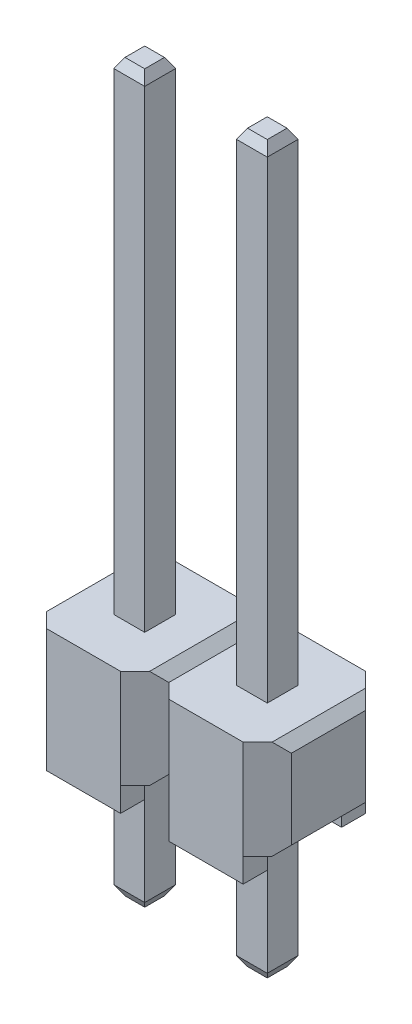
from build123d import *
from OCP.BRepFilletAPI import BRepFilletAPI_MakeChamfer

# Parameters (mm, degrees)
SKETCH1_W                = 0.64
SKETCH1_H                = 0.64
BOSS_EXTRUDE1_DEPTH      = 2.05
CUT_EXTRUDE1_DEPTH       = 5
SKETCH3_W                = 1.54
SKETCH3_H                = 0.5
BOSS_EXTRUDE2_DEPTH      = 0.5
BOSS_EXTRUDE3_DEPTH      = 10
BOSS_EXTRUDE3_DEPTH_BACK = 5.05
SKETCH4_W                = 0.64
SKETCH4_H                = 0.64
CHAMFER1_SIZE            = 0.2
CHAMFER1_SIZE2           = 0.115470054
SKETCH5_R                = 0.125
CUT_EXTRUDE2_DEPTH       = 1


with BuildPart() as part:
    # Sketch1 → Boss-Extrude1 (new body)
    with BuildSketch(Plane(origin=(0, 0, 0), x_dir=(1, 0, 0), z_dir=(0, 1, 0))):
        Polygon((-2.04, -1.27), (-0.5, -1.27), (0, -0.77), (0.5, -1.27), (2.04, -1.27), (2.54, -0.77), (2.54, 0.77), (2.04, 1.27), (0.5, 1.27), (0, 0.77), (-0.5, 1.27), (-2.04, 1.27), (-2.54, 0.77), (-2.54, -0.77), align=None)
        with Locations((1.27, 0)):
            Rectangle(SKETCH1_W, SKETCH1_H, mode=Mode.SUBTRACT)
        with Locations((-1.27, 0)):
            Rectangle(SKETCH1_W, SKETCH1_H, mode=Mode.SUBTRACT)
    extrude(amount=-BOSS_EXTRUDE1_DEPTH)

    # Sketch2 → Cut-Extrude1 (cut, symmetric)
    with BuildSketch(Plane.XY):
        Polygon((-2.54, -0.2), (-2.54, 0), (-2.34, 0), align=None)
        Polygon((-0.2, 0), (0.2, 0), (0, -0.2), align=None)
        Polygon((2.34, 0), (2.54, 0), (2.54, -0.2), align=None)
        Polygon((-2.54, -1.85), (-2.34, -2.05), (-2.54, -2.05), align=None)
        Polygon((-0.2, -2.05), (0, -1.85), (0.2, -2.05), align=None)
        Polygon((2.34, -2.05), (2.54, -1.85), (2.54, -2.05), align=None)
    extrude(amount=CUT_EXTRUDE1_DEPTH, both=True, mode=Mode.SUBTRACT)

    # Sketch3 → Boss-Extrude2 (add)
    with BuildSketch(Plane.XZ.offset(2.05)):
        with Locations((-1.27, -1.02)):
            Rectangle(SKETCH3_W, SKETCH3_H)
        with Locations((-1.27, 1.02)):
            Rectangle(SKETCH3_W, SKETCH3_H)
        with Locations((1.27, 1.02)):
            Rectangle(SKETCH3_W, SKETCH3_H)
        with Locations((1.27, -1.02)):
            Rectangle(SKETCH3_W, SKETCH3_H)
    extrude(amount=BOSS_EXTRUDE2_DEPTH)

    # Sketch4 → Boss-Extrude3 (add, two sides: drawn at the far end of the back side and taken through both)
    with BuildSketch(Plane(origin=(0, 0, 0), x_dir=(1, 0, 0), z_dir=(0, 1, 0)).offset(-BOSS_EXTRUDE3_DEPTH_BACK)):
        with Locations((-1.27, 0)):
            Rectangle(SKETCH4_W, SKETCH4_H)
        with Locations((1.27, 0)):
            Rectangle(SKETCH4_W, SKETCH4_H)
    extrude(amount=BOSS_EXTRUDE3_DEPTH + BOSS_EXTRUDE3_DEPTH_BACK)

    # Chamfer1: one chamfer whose edges measure the first distance from different faces: ONE call of the kernel's chamfer builder (chamfer() names one face for all edges)
    chamfer1_edges_1 = [part.edges().sort_by_distance(p)[0] for p in [
        (-1.59, -5.05, 0),
    ]]
    chamfer1_side_1 = [part.faces().sort_by_distance(p)[0] for p in [
        (-1.59, -3.55, 0),
    ]]
    chamfer1_edges_2 = [part.edges().sort_by_distance(p)[0] for p in [
        (-1.27, -5.05, -0.32),
    ]]
    chamfer1_side_2 = [part.faces().sort_by_distance(p)[0] for p in [
        (-1.27, -3.55, -0.32),
    ]]
    chamfer1_edges_3 = [part.edges().sort_by_distance(p)[0] for p in [
        (-0.95, -5.05, 0),
    ]]
    chamfer1_side_3 = [part.faces().sort_by_distance(p)[0] for p in [
        (-0.95, -3.55, 0),
    ]]
    chamfer1_edges_4 = [part.edges().sort_by_distance(p)[0] for p in [
        (-1.27, -5.05, 0.32),
    ]]
    chamfer1_side_4 = [part.faces().sort_by_distance(p)[0] for p in [
        (-1.27, -3.55, 0.32),
    ]]
    chamfer1_edges_5 = [part.edges().sort_by_distance(p)[0] for p in [
        (-1.59, 10, 0),
    ]]
    chamfer1_side_5 = [part.faces().sort_by_distance(p)[0] for p in [
        (-1.59, 5, 0),
    ]]
    chamfer1_edges_6 = [part.edges().sort_by_distance(p)[0] for p in [
        (-1.27, 10, 0.32),
    ]]
    chamfer1_side_6 = [part.faces().sort_by_distance(p)[0] for p in [
        (-1.27, 5, 0.32),
    ]]
    chamfer1_edges_7 = [part.edges().sort_by_distance(p)[0] for p in [
        (-0.95, 10, 0),
    ]]
    chamfer1_side_7 = [part.faces().sort_by_distance(p)[0] for p in [
        (-0.95, 5, 0),
    ]]
    chamfer1_edges_8 = [part.edges().sort_by_distance(p)[0] for p in [
        (-1.27, 10, -0.32),
    ]]
    chamfer1_side_8 = [part.faces().sort_by_distance(p)[0] for p in [
        (-1.27, 5, -0.32),
    ]]
    chamfer1_edges_9 = [part.edges().sort_by_distance(p)[0] for p in [
        (0.95, -5.05, 0),
    ]]
    chamfer1_side_9 = [part.faces().sort_by_distance(p)[0] for p in [
        (0.95, -3.55, 0),
    ]]
    chamfer1_edges_10 = [part.edges().sort_by_distance(p)[0] for p in [
        (1.27, -5.05, -0.32),
    ]]
    chamfer1_side_10 = [part.faces().sort_by_distance(p)[0] for p in [
        (1.27, -3.55, -0.32),
    ]]
    chamfer1_edges_11 = [part.edges().sort_by_distance(p)[0] for p in [
        (1.59, -5.05, 0),
    ]]
    chamfer1_side_11 = [part.faces().sort_by_distance(p)[0] for p in [
        (1.59, -3.55, 0),
    ]]
    chamfer1_edges_12 = [part.edges().sort_by_distance(p)[0] for p in [
        (1.27, -5.05, 0.32),
    ]]
    chamfer1_side_12 = [part.faces().sort_by_distance(p)[0] for p in [
        (1.27, -3.55, 0.32),
    ]]
    chamfer1_edges_13 = [part.edges().sort_by_distance(p)[0] for p in [
        (0.95, 10, 0),
    ]]
    chamfer1_side_13 = [part.faces().sort_by_distance(p)[0] for p in [
        (0.95, 5, 0),
    ]]
    chamfer1_edges_14 = [part.edges().sort_by_distance(p)[0] for p in [
        (1.27, 10, 0.32),
    ]]
    chamfer1_side_14 = [part.faces().sort_by_distance(p)[0] for p in [
        (1.27, 5, 0.32),
    ]]
    chamfer1_edges_15 = [part.edges().sort_by_distance(p)[0] for p in [
        (1.59, 10, 0),
    ]]
    chamfer1_side_15 = [part.faces().sort_by_distance(p)[0] for p in [
        (1.59, 5, 0),
    ]]
    chamfer1_edges_16 = [part.edges().sort_by_distance(p)[0] for p in [
        (1.27, 10, -0.32),
    ]]
    chamfer1_side_16 = [part.faces().sort_by_distance(p)[0] for p in [
        (1.27, 5, -0.32),
    ]]
    chamfer1 = BRepFilletAPI_MakeChamfer(part.part.solid().wrapped)
    for e in chamfer1_edges_1:
        chamfer1.Add(CHAMFER1_SIZE, CHAMFER1_SIZE2, e.wrapped, chamfer1_side_1[0].wrapped)  # the first distance lies on this face
    for e in chamfer1_edges_2:
        chamfer1.Add(CHAMFER1_SIZE, CHAMFER1_SIZE2, e.wrapped, chamfer1_side_2[0].wrapped)  # the first distance lies on this face
    for e in chamfer1_edges_3:
        chamfer1.Add(CHAMFER1_SIZE, CHAMFER1_SIZE2, e.wrapped, chamfer1_side_3[0].wrapped)  # the first distance lies on this face
    for e in chamfer1_edges_4:
        chamfer1.Add(CHAMFER1_SIZE, CHAMFER1_SIZE2, e.wrapped, chamfer1_side_4[0].wrapped)  # the first distance lies on this face
    for e in chamfer1_edges_5:
        chamfer1.Add(CHAMFER1_SIZE, CHAMFER1_SIZE2, e.wrapped, chamfer1_side_5[0].wrapped)  # the first distance lies on this face
    for e in chamfer1_edges_6:
        chamfer1.Add(CHAMFER1_SIZE, CHAMFER1_SIZE2, e.wrapped, chamfer1_side_6[0].wrapped)  # the first distance lies on this face
    for e in chamfer1_edges_7:
        chamfer1.Add(CHAMFER1_SIZE, CHAMFER1_SIZE2, e.wrapped, chamfer1_side_7[0].wrapped)  # the first distance lies on this face
    for e in chamfer1_edges_8:
        chamfer1.Add(CHAMFER1_SIZE, CHAMFER1_SIZE2, e.wrapped, chamfer1_side_8[0].wrapped)  # the first distance lies on this face
    for e in chamfer1_edges_9:
        chamfer1.Add(CHAMFER1_SIZE, CHAMFER1_SIZE2, e.wrapped, chamfer1_side_9[0].wrapped)  # the first distance lies on this face
    for e in chamfer1_edges_10:
        chamfer1.Add(CHAMFER1_SIZE, CHAMFER1_SIZE2, e.wrapped, chamfer1_side_10[0].wrapped)  # the first distance lies on this face
    for e in chamfer1_edges_11:
        chamfer1.Add(CHAMFER1_SIZE, CHAMFER1_SIZE2, e.wrapped, chamfer1_side_11[0].wrapped)  # the first distance lies on this face
    for e in chamfer1_edges_12:
        chamfer1.Add(CHAMFER1_SIZE, CHAMFER1_SIZE2, e.wrapped, chamfer1_side_12[0].wrapped)  # the first distance lies on this face
    for e in chamfer1_edges_13:
        chamfer1.Add(CHAMFER1_SIZE, CHAMFER1_SIZE2, e.wrapped, chamfer1_side_13[0].wrapped)  # the first distance lies on this face
    for e in chamfer1_edges_14:
        chamfer1.Add(CHAMFER1_SIZE, CHAMFER1_SIZE2, e.wrapped, chamfer1_side_14[0].wrapped)  # the first distance lies on this face
    for e in chamfer1_edges_15:
        chamfer1.Add(CHAMFER1_SIZE, CHAMFER1_SIZE2, e.wrapped, chamfer1_side_15[0].wrapped)  # the first distance lies on this face
    for e in chamfer1_edges_16:
        chamfer1.Add(CHAMFER1_SIZE, CHAMFER1_SIZE2, e.wrapped, chamfer1_side_16[0].wrapped)  # the first distance lies on this face
    add(Compound.cast(chamfer1.Shape()), mode=Mode.REPLACE)

    # Sketch5 → Cut-Extrude2 (cut)
    with BuildSketch(Plane.XZ.offset(5.05)):
        with Locations(Location((-1.27, 0, 0), (0, 0, 270))):
            Circle(SKETCH5_R)
    extrude(amount=-CUT_EXTRUDE2_DEPTH, mode=Mode.SUBTRACT)


solid = part.part
